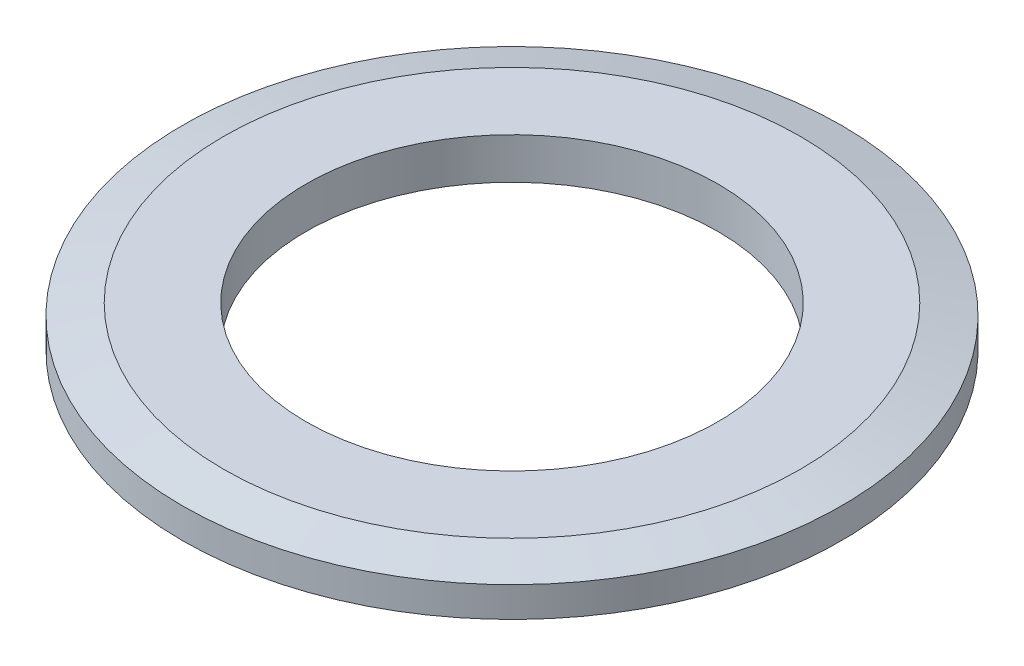
from build123d import *

# Parameters (mm, degrees)
SKETCH1_R           = 8
SKETCH1_R_2         = 5
BOSS_EXTRUDE1_DEPTH = 1
CHAMFER1_SIZE       = 1
CHAMFER1_SIZE2      = 0.267949192


with BuildPart() as part:
    # Sketch1 → Boss-Extrude1 (new body)
    with BuildSketch(Plane(origin=(0, 0, 0), x_dir=(1, 0, 0), z_dir=(0, 1, 0))):
        with Locations(Location((0, 0, 0), (0, 0, 270))):
            Circle(SKETCH1_R)
        with Locations(Location((0, 0, 0), (0, 0, 270))):
            Circle(SKETCH1_R_2, mode=Mode.SUBTRACT)
    extrude(amount=BOSS_EXTRUDE1_DEPTH)

    # Chamfer1
    chamfer1_edges = [part.edges().sort_by_distance(p)[0] for p in [
        (0, 1, -8),
    ]]
    chamfer1_side = [part.faces().sort_by_distance(p)[0] for p in [
        (0, 1, -7.77372583),
    ]]
    chamfer(chamfer1_edges, length=CHAMFER1_SIZE, length2=CHAMFER1_SIZE2, reference=chamfer1_side[0])


solid = part.part
